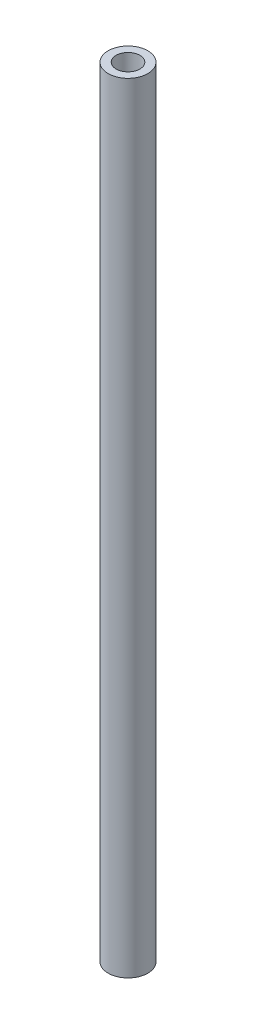
from build123d import *

# Parameters (mm, degrees)
SKETCH1_R           = 2.5
SKETCH1_R_2         = 1.5
BOSS_EXTRUDE1_DEPTH = 98.298


with BuildPart() as part:
    # Sketch1 → Boss-Extrude1 (new body)
    with BuildSketch(Plane(origin=(0, 0, 0), x_dir=(1, 0, 0), z_dir=(0, 1, 0))):
        with Locations(Location((0, 0, 0), (0, 0, 90))):
            Circle(SKETCH1_R)
        with Locations(Location((0, 0, 0), (0, 0, 90))):
            Circle(SKETCH1_R_2, mode=Mode.SUBTRACT)
    extrude(amount=BOSS_EXTRUDE1_DEPTH)


solid = part.part
